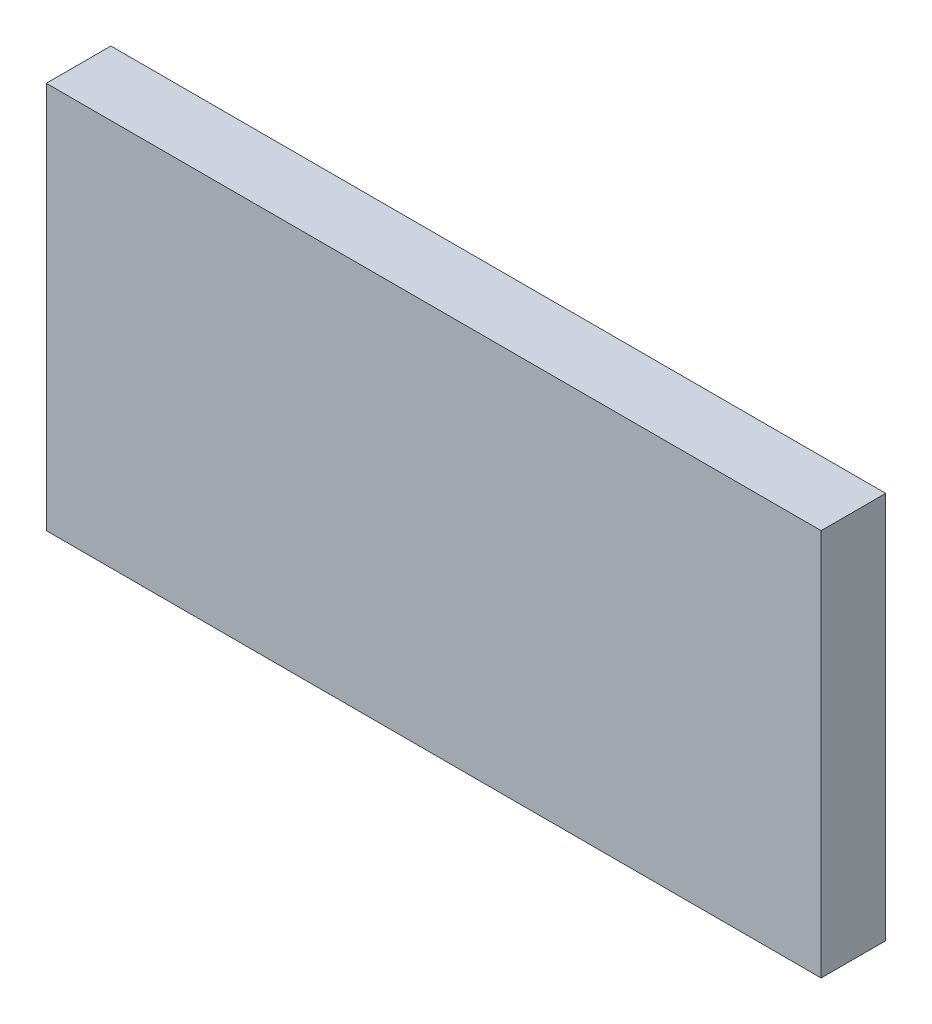
from build123d import *

# Parameters (mm, degrees)
SKETCH_1_W      = 120
SKETCH_1_H      = 60
EXTRUDE_1_DEPTH = 10


with BuildPart() as part:
    # 스케치1 → 보스-돌출1 (new body)
    with BuildSketch(Plane.XY):
        Rectangle(SKETCH_1_W, SKETCH_1_H)
    extrude(amount=EXTRUDE_1_DEPTH)


solid = part.part
